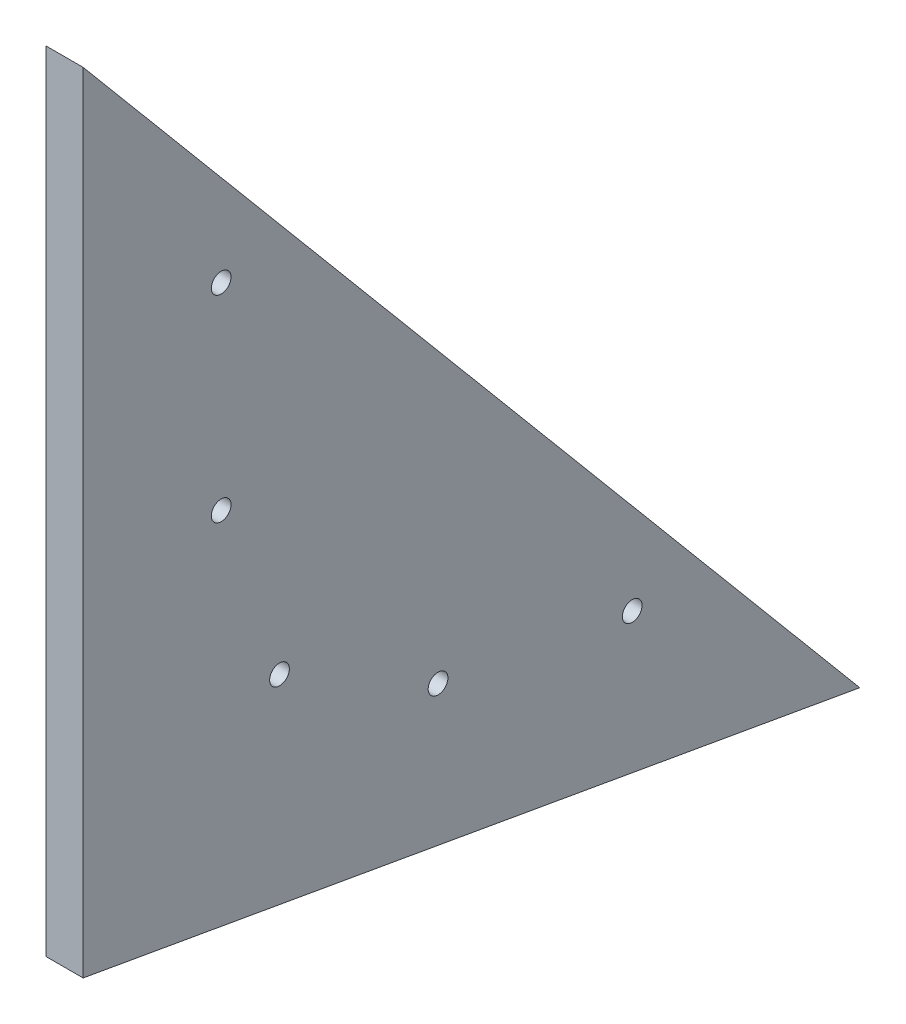
from build123d import *

# Parameters (mm, degrees)
BOSS_EXTRUDE1_DEPTH         = 11.90625
F_1_4_0_25_DIAMETER_HOLE1_D = 6.35


with BuildPart() as part:
    # Sketch1 → Boss-Extrude1 (new body)
    with BuildSketch(Plane(origin=(0, 0, 0), x_dir=(0, 0, -1), z_dir=(1, 0, 0))):
        Polygon((0, 0), (0, 254), (250.141169265, -44.106637127), align=None)
    extrude(amount=BOSS_EXTRUDE1_DEPTH)

    # 1/4 (0.25) Diameter Hole1 (through all)
    with Locations(Plane.ZY):
        with Locations((-44.45, 171.725527446), (-44.45, 108.225527446), (-63.236968779, 53.06211718), (-114.3, 24.981539003), (-176.835292316, 13.954879721)):
            Hole(F_1_4_0_25_DIAMETER_HOLE1_D / 2)


solid = part.part
